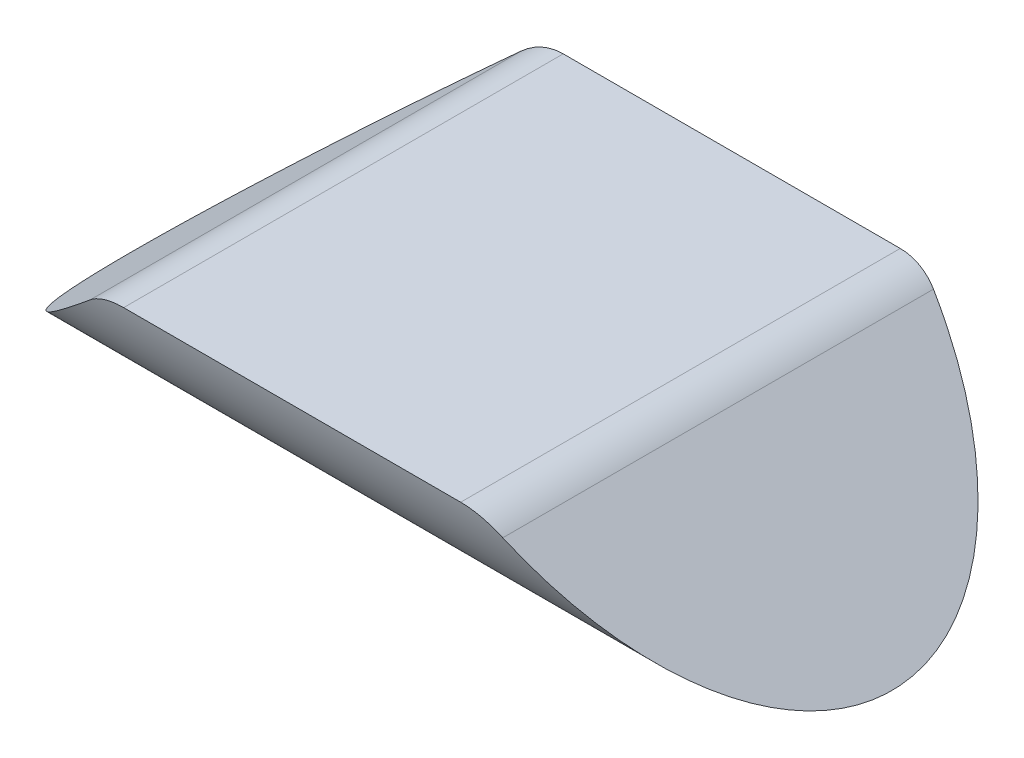
from build123d import *

# Parameters (mm, degrees)
BOSS_EXTRUDE1_DEPTH = 127
CUT_EXTRUDE3_DEPTH  = 166.314783368
FILLET3_R           = 19.05


with BuildPart() as part:
    # Sketch1 → Boss-Extrude1 (new, symmetric)
    with BuildSketch(Plane(origin=(0, 0, 0), x_dir=(0, 0, -1), z_dir=(1, 0, 0))):
        with BuildLine():
            Line((-73.440708058, -20.32), (73.440708058, -20.32))
            ThreePointArc((73.440708058, -20.32), (0, -76.2), (-73.440708058, -20.32))
        make_face()
    extrude(amount=BOSS_EXTRUDE1_DEPTH, both=True)

    # Sketch7 → Cut-Extrude3 (cut, symmetric)
    with BuildSketch(Plane.XY):
        Polygon((-63.5, -20.32), (-127, -20.32), (-127, -76.2), align=None)
    cut_extrude3 = extrude(amount=CUT_EXTRUDE3_DEPTH, both=True, mode=Mode.SUBTRACT)

    # Mirror4: Cut-Extrude3 across plane
    add(cut_extrude3.mirror(Plane(origin=(0, 0, 0), x_dir=(0, 0, 1), z_dir=(1, 0, 0))), mode=Mode.SUBTRACT)

    # Fillet3
    fillet3_edges = [part.edges().sort_by_distance(p)[0] for p in [
        (63.5, -20.32, 0),
        (-63.5, -20.32, 0),
    ]]
    fillet(fillet3_edges, radius=FILLET3_R)


with BuildPart() as body_2:
    # Split1: the piece on the far side of the plane
    add(part.part)
    split(bisect_by=Plane(origin=(0, 0, 0), x_dir=(0, 0, 1), z_dir=(1, 0, 0)), keep=Keep.BOTTOM)


with BuildPart() as part_1:
    add(part.part)

    # Split1
    split(bisect_by=Plane(origin=(0, 0, 0), x_dir=(0, 0, 1), z_dir=(1, 0, 0)), keep=Keep.TOP)


with BuildPart() as body_2_1:
    add(body_2.part)

    # Combine1: union part
    add(part_1.part)


solid = body_2_1.part
